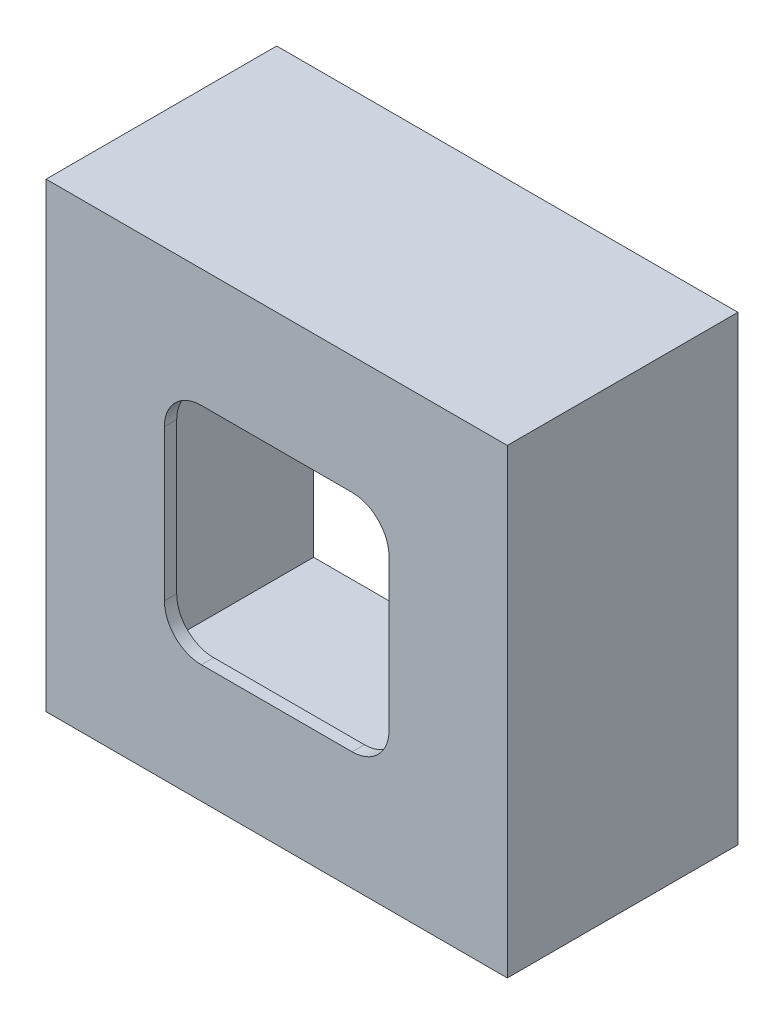
from build123d import *

# Parameters (mm, degrees)
SKETCH1_W           = 75
SKETCH1_H           = 75
BOSS_EXTRUDE1_DEPTH = 2
SKETCH2_W           = 75
SKETCH2_H           = 75
SKETCH2_W_2         = 63
SKETCH2_H_2         = 63
BOSS_EXTRUDE2_DEPTH = 35.5


with BuildPart() as part:
    # Sketch1 → Boss-Extrude1 (new body)
    with BuildSketch(Plane.XY):
        Rectangle(SKETCH1_W, SKETCH1_H)
        with BuildLine():
            Line((12.263455967, 18.263455967), (-12.263455967, 18.263455967))
            ThreePointArc((-12.263455967, 18.263455967), (-16.506096654, 16.506096654), (-18.263455967, 12.263455967))
            Line((-18.263455967, 12.263455967), (-18.263455967, -12.263455967))
            ThreePointArc((-18.263455967, -12.263455967), (-16.506096654, -16.506096654), (-12.263455967, -18.263455967))
            Line((-12.263455967, -18.263455967), (12.263455967, -18.263455967))
            ThreePointArc((12.263455967, -18.263455967), (16.506096654, -16.506096654), (18.263455967, -12.263455967))
            Line((18.263455967, -12.263455967), (18.263455967, 12.263455967))
            ThreePointArc((18.263455967, 12.263455967), (16.506096654, 16.506096654), (12.263455967, 18.263455967))
        make_face(mode=Mode.SUBTRACT)
    extrude(amount=-BOSS_EXTRUDE1_DEPTH)

    # Sketch2 → Boss-Extrude2 (add)
    with BuildSketch(Plane(origin=(0, 0, -2), x_dir=(-1, 0, 0), z_dir=(0, 0, -1))):
        Rectangle(SKETCH2_W, SKETCH2_H)
        Rectangle(SKETCH2_W_2, SKETCH2_H_2, mode=Mode.SUBTRACT)
    extrude(amount=BOSS_EXTRUDE2_DEPTH)


solid = part.part
